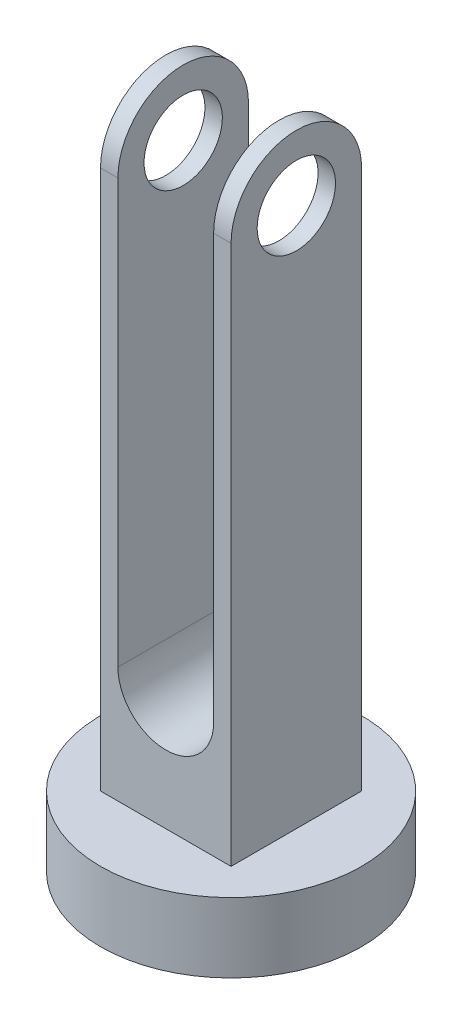
from build123d import *

# Parameters (mm, degrees)
SKETCH1_R           = 75
BOSS_EXTRUDE1_DEPTH = 40
SKETCH3_W           = 75
SKETCH3_H           = 75
BOSS_EXTRUDE2_DEPTH = 347.5
CUT_EXTRUDE1_DEPTH  = 80
SKETCH4_R           = 22.5
CUT_EXTRUDE2_DEPTH  = 80
CUT_EXTRUDE3_DEPTH  = 80


with BuildPart() as part:
    # Sketch1 → Boss-Extrude1 (new body)
    with BuildSketch(Plane(origin=(0, 0, 0), x_dir=(1, 0, 0), z_dir=(0, 1, 0))):
        with Locations(Location((0, 0, 0), (0, 0, 270))):
            Circle(SKETCH1_R)
    extrude(amount=BOSS_EXTRUDE1_DEPTH)

    # Sketch3 → Boss-Extrude2 (add)
    with BuildSketch(Plane(origin=(0, 40, 0), x_dir=(1, 0, 0), z_dir=(0, 1, 0))):
        Rectangle(SKETCH3_W, SKETCH3_H)
    extrude(amount=BOSS_EXTRUDE2_DEPTH)

    # Sketch5 → Cut-Extrude1 (cut)
    with BuildSketch(Plane.ZY.offset(37.5)):
        with BuildLine():
            Line((37.5, 387.5), (0, 387.5))
            ThreePointArc((0, 387.5), (26.516504294, 376.516504294), (37.5, 350))
            Line((37.5, 350), (37.5, 387.5))
        make_face()
        with BuildLine():
            Line((-37.5, 387.5), (-37.5, 350))
            ThreePointArc((-37.5, 350), (-26.516504294, 376.516504294), (0, 387.5))
            Line((0, 387.5), (-37.5, 387.5))
        make_face()
    extrude(amount=-CUT_EXTRUDE1_DEPTH, mode=Mode.SUBTRACT)

    # Sketch4 → Cut-Extrude2 (cut)
    with BuildSketch(Plane.ZY.offset(37.5)):
        with Locations((0, 350)):
            Circle(SKETCH4_R)
    extrude(amount=-CUT_EXTRUDE2_DEPTH, mode=Mode.SUBTRACT)

    # Sketch6 → Cut-Extrude3 (cut)
    with BuildSketch(Plane.XY.offset(37.5)):
        with BuildLine():
            Line((27.5, 401.577624338), (-27.5, 401.577624338))
            Line((-27.5, 401.577624338), (-27.5, 106.661183131))
            ThreePointArc((-27.5, 106.661183131), (0, 79.161183131), (27.5, 106.661183131))
            Line((27.5, 106.661183131), (27.5, 401.577624338))
        make_face()
    extrude(amount=-CUT_EXTRUDE3_DEPTH, mode=Mode.SUBTRACT)


solid = part.part
